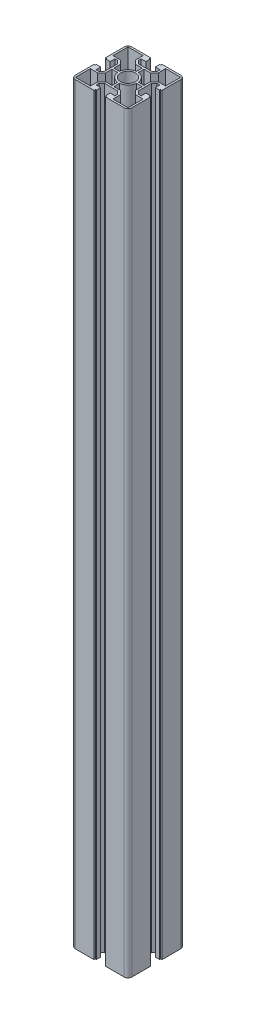
from build123d import *

# Parameters (mm, degrees)
SKETCH_1_R      = 8
EXTRUDE_1_DEPTH = 800


with BuildPart() as part:
    # 草图1 → 凸台-拉伸1 (new body)
    with BuildSketch(Plane(origin=(0, 0, 0), x_dir=(1, 0, 0), z_dir=(0, 1, 0))):
        with BuildLine():
            Line((-30, 5.999999999), (-28.5, 5.999999999))
            Line((-28.5, 5.999999999), (-28.5, 4.999999999))
            Line((-28.5, 4.999999999), (-24, 4.999999999))
            Line((-24, 4.999999999), (-24, 9.999999999))
            Line((-24, 9.999999999), (-21, 9.999999999))
            Line((-21, 9.999999999), (-18, 6.999999999))
            Line((-18, 6.999999999), (-18, -7.000000001))
            Line((-18, -7.000000001), (-21, -10.000000001))
            Line((-21, -10.000000001), (-24, -10.000000001))
            Line((-24, -10.000000001), (-24, -5.000000001))
            Line((-24, -5.000000001), (-28.5, -5.000000001))
            Line((-28.5, -5.000000001), (-28.5, -6.000000001))
            Line((-28.5, -6.000000001), (-30, -6.000000001))
            Line((-30, -6.000000001), (-30, -26.000000001))
            ThreePointArc((-30, -26.000000001), (-28.828427125, -28.828427126), (-26, -30.000000001))
            Line((-26, -30.000000001), (-6, -30.000000001))
            Line((-6, -30.000000001), (-6, -28.500000001))
            Line((-6, -28.500000001), (-5, -28.500000001))
            Line((-5, -28.500000001), (-5, -24.000000001))
            Line((-5, -24.000000001), (-10, -24.000000001))
            Line((-10, -24.000000001), (-10, -21.000000001))
            Line((-10, -21.000000001), (-7, -18.000000001))
            Line((-7, -18.000000001), (7, -18.000000001))
            Line((7, -18.000000001), (10, -21.000000001))
            Line((10, -21.000000001), (10, -24.000000001))
            Line((10, -24.000000001), (5, -24.000000001))
            Line((5, -24.000000001), (5, -28.500000001))
            Line((5, -28.500000001), (6, -28.500000001))
            Line((6, -28.500000001), (6, -30.000000001))
            Line((6, -30.000000001), (26, -30.000000001))
            ThreePointArc((26, -30.000000001), (28.828427125, -28.828427126), (30, -26.000000001))
            Line((30, -26.000000001), (30, -6.000000001))
            Line((30, -6.000000001), (28.5, -6.000000001))
            Line((28.5, -6.000000001), (28.5, -5.000000001))
            Line((28.5, -5.000000001), (24, -5.000000001))
            Line((24, -5.000000001), (24, -10.000000001))
            Line((24, -10.000000001), (21, -10.000000001))
            Line((21, -10.000000001), (18, -7.000000001))
            Line((18, -7.000000001), (18, 6.999999999))
            Line((18, 6.999999999), (21, 9.999999999))
            Line((21, 9.999999999), (24, 9.999999999))
            Line((24, 9.999999999), (24, 4.999999999))
            Line((24, 4.999999999), (28.5, 4.999999999))
            Line((28.5, 4.999999999), (28.5, 5.999999999))
            Line((28.5, 5.999999999), (30, 5.999999999))
            Line((30, 5.999999999), (30, 25.999999999))
            ThreePointArc((30, 25.999999999), (28.828427125, 28.828427124), (26, 29.999999999))
            Line((26, 29.999999999), (6, 29.999999999))
            Line((6, 29.999999999), (6, 28.499999999))
            Line((6, 28.499999999), (5, 28.499999999))
            Line((5, 28.499999999), (5, 23.999999999))
            Line((5, 23.999999999), (10, 23.999999999))
            Line((10, 23.999999999), (10, 20.999999999))
            Line((10, 20.999999999), (7, 17.999999999))
            Line((7, 17.999999999), (-7, 17.999999999))
            Line((-7, 17.999999999), (-10, 20.999999999))
            Line((-10, 20.999999999), (-10, 23.999999999))
            Line((-10, 23.999999999), (-5, 23.999999999))
            Line((-5, 23.999999999), (-5, 28.499999999))
            Line((-5, 28.499999999), (-6, 28.499999999))
            Line((-6, 28.499999999), (-6, 29.999999999))
            Line((-6, 29.999999999), (-26.000000001, 29.999999999))
            ThreePointArc((-26.000000001, 29.999999999), (-28.828427125, 28.828427123), (-30, 25.999999999))
            Line((-30, 25.999999999), (-30, 5.999999999))
        make_face()
        with Locations(Location((0, 0, 0), (0, 0, 270))):
            Circle(SKETCH_1_R, mode=Mode.SUBTRACT)
        with BuildLine():
            Line((-16, 1), (-9.949874371, 1))
            ThreePointArc((-9.949874371, 1), (-7.071067812, 7.071067811), (-1.000000001, 9.949874371))
            Line((-1.000000001, 9.949874371), (-1.000000001, 16))
            Line((-1.000000001, 16), (-7.828427125, 16))
            Line((-7.828427125, 16), (-12, 20.171572875))
            Line((-12, 20.171572875), (-12, 28))
            Line((-12, 28), (-28, 28))
            Line((-28, 28), (-28, 12))
            Line((-28, 12), (-20.171572875, 12))
            Line((-20.171572875, 12), (-16, 7.828427125))
            Line((-16, 7.828427125), (-16, 1))
        make_face(mode=Mode.SUBTRACT)
        with BuildLine():
            Line((1, 9.949874371), (1, 16))
            Line((1, 16), (7.828427125, 16))
            Line((7.828427125, 16), (12, 20.171572875))
            Line((12, 20.171572875), (12, 28))
            Line((12, 28), (28, 28))
            Line((28, 28), (28, 12.000000001))
            Line((28, 12.000000001), (20.171572875, 12.000000001))
            Line((20.171572875, 12.000000001), (16, 7.828427126))
            Line((16, 7.828427126), (16, 1.000000001))
            Line((16, 1.000000001), (9.949874371, 1.000000001))
            ThreePointArc((9.949874371, 1.000000001), (7.071067811, 7.071067812), (1, 9.949874371))
        make_face(mode=Mode.SUBTRACT)
        with BuildLine():
            Line((9.949874371, -1), (16, -1))
            Line((16, -1), (16, -7.828427125))
            Line((16, -7.828427125), (20.171572875, -12))
            Line((20.171572875, -12), (28.000000001, -12))
            Line((28.000000001, -12), (28.000000001, -28))
            Line((28.000000001, -28), (12.000000001, -28))
            Line((12.000000001, -28), (12.000000001, -20.171572875))
            Line((12.000000001, -20.171572875), (7.828427126, -16))
            Line((7.828427126, -16), (1.000000001, -16))
            Line((1.000000001, -16), (1.000000001, -9.949874371))
            ThreePointArc((1.000000001, -9.949874371), (7.071067812, -7.071067811), (9.949874371, -1))
        make_face(mode=Mode.SUBTRACT)
        with BuildLine():
            Line((-1, -9.949874371), (-1, -16.000000001))
            Line((-1, -16.000000001), (-7.828427125, -16.000000001))
            Line((-7.828427125, -16.000000001), (-12, -20.171572876))
            Line((-12, -20.171572876), (-12, -28.000000001))
            Line((-12, -28.000000001), (-28, -28.000000001))
            Line((-28, -28.000000001), (-28, -12.000000001))
            Line((-28, -12.000000001), (-20.171572875, -12.000000001))
            Line((-20.171572875, -12.000000001), (-16, -7.828427126))
            Line((-16, -7.828427126), (-16, -1.000000001))
            Line((-16, -1.000000001), (-9.949874371, -1.000000001))
            ThreePointArc((-9.949874371, -1.000000001), (-7.071067811, -7.071067812), (-1, -9.949874371))
        make_face(mode=Mode.SUBTRACT)
    extrude(amount=EXTRUDE_1_DEPTH)


solid = part.part
